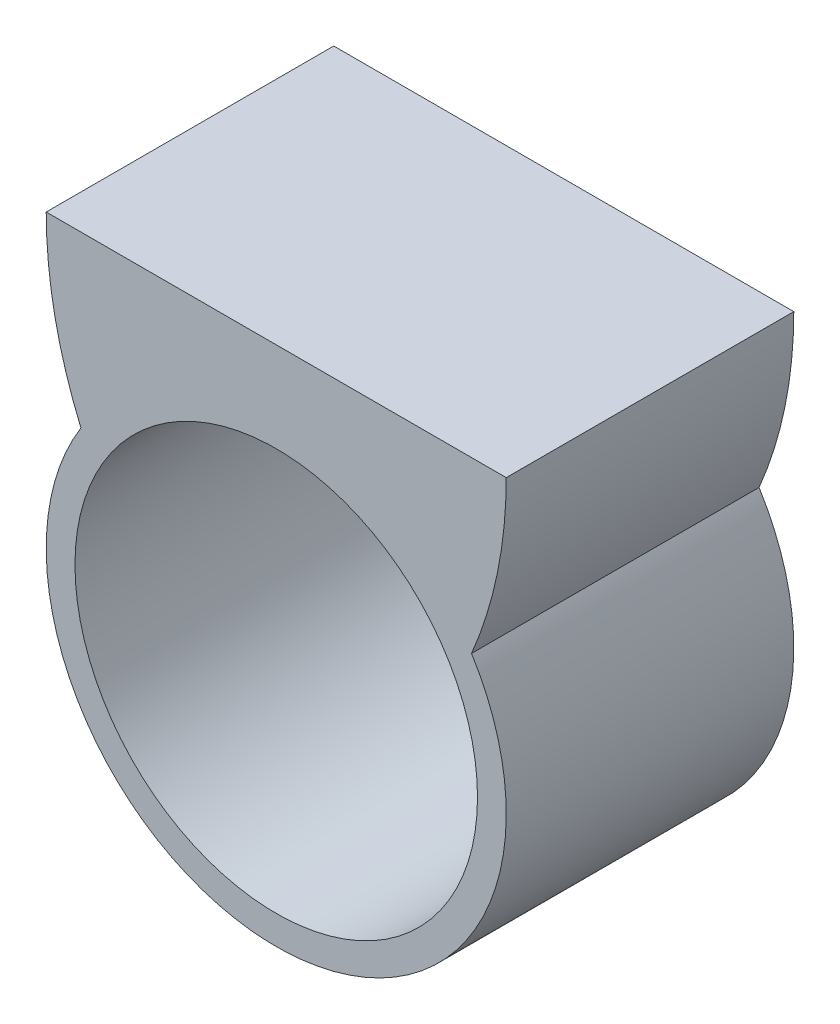
from build123d import *

# Parameters (mm, degrees)
SKETCH1_R           = 40
SKETCH1_R_2         = 35
BOSS_EXTRUDE1_DEPTH = 50
BOSS_EXTRUDE2_START = -50
BOSS_EXTRUDE2_DEPTH = 50
SCALE1_SCALE        = 1.5


with BuildPart() as part:
    # Sketch1 → Boss-Extrude1 (new body)
    with BuildSketch(Plane.XY):
        Circle(SKETCH1_R)
        Circle(SKETCH1_R_2, mode=Mode.SUBTRACT)
    extrude(amount=BOSS_EXTRUDE1_DEPTH)

    # Sketch2 → Boss-Extrude2 (add)
    with BuildSketch(Plane.XY.offset(50).offset(BOSS_EXTRUDE2_START)):
        with BuildLine():
            Line((0, 40), (0, 50.63587493))
            Line((0, 50.63587493), (-40, 50.63587493))
            ThreePointArc((-40, 50.63587493), (-38.47413578, 35.580764102), (-33.958601629, 21.137960531))
            ThreePointArc((-33.958601629, 21.137960531), (-19.422687491, 34.967974071), (0, 40))
        make_face()
        with BuildLine():
            ThreePointArc((33.958601629, 21.137960531), (38.47413578, 35.580764102), (40, 50.63587493))
            Line((40, 50.63587493), (0, 50.63587493))
            Line((0, 50.63587493), (0, 40))
            ThreePointArc((0, 40), (19.422687491, 34.967974071), (33.958601629, 21.137960531))
        make_face()
    extrude(amount=BOSS_EXTRUDE2_DEPTH)


with BuildPart() as part_1:
    # Scale1: scaled about (0, 21.957707066, 25)
    add(part.part.scale(SCALE1_SCALE).moved(Location((0, -10.978853533, -12.5))))


solid = part_1.part
